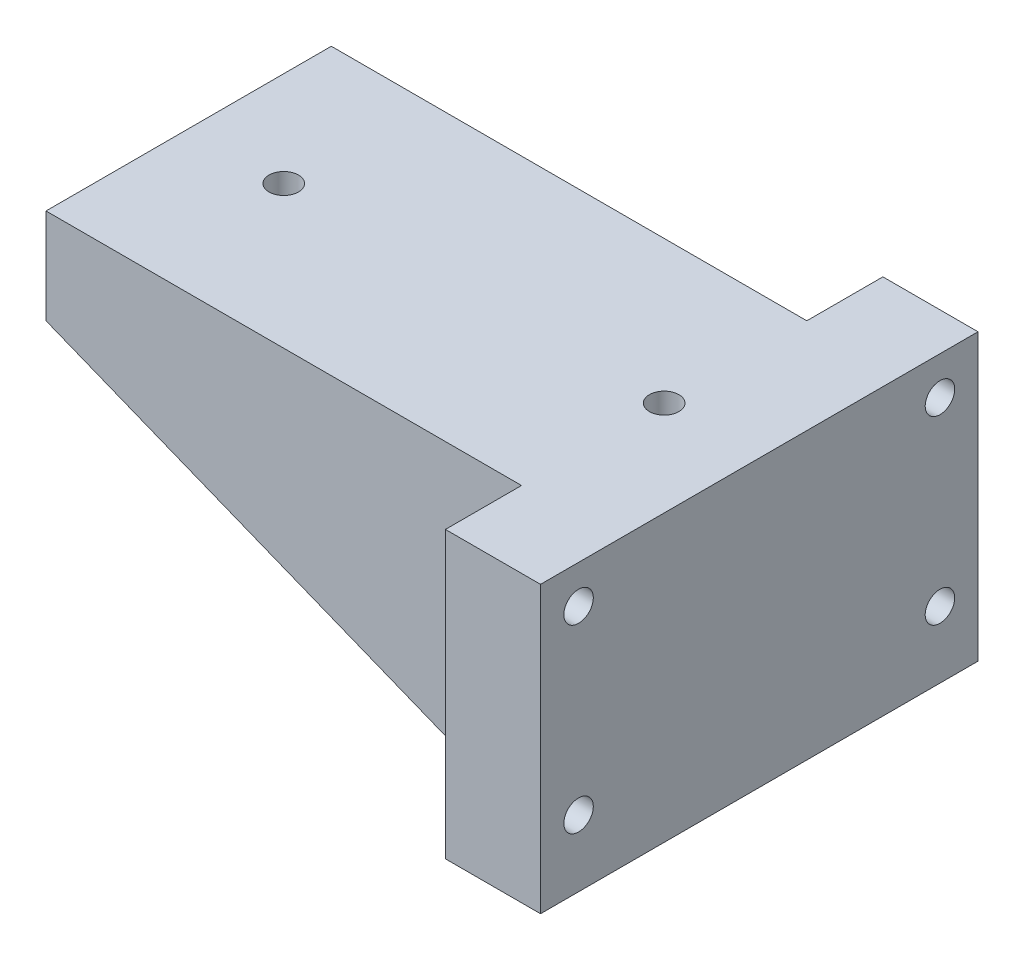
from build123d import *

# Parameters (mm, degrees)
SKETCH1_W           = 60
SKETCH1_H           = 30
SKETCH1_R           = 1.55
BOSS_EXTRUDE1_DEPTH = 10
SKETCH2_R           = 1.55
BOSS_EXTRUDE3_DEPTH = 10
SKETCH2_3_W         = 10
SKETCH2_3_H         = 20
BOSS_EXTRUDE4_DEPTH = 6
BOSS_EXTRUDE5_DEPTH = 6
BOSS_EXTRUDE6_DEPTH = 6


with BuildPart() as part:
    # Sketch1 → Boss-Extrude1 (new body)
    with BuildSketch(Plane(origin=(0, 0, 0), x_dir=(1, 0, 0), z_dir=(0, 1, 0))):
        Rectangle(SKETCH1_W, SKETCH1_H)
        with Locations((20, 0)):
            Circle(SKETCH1_R, mode=Mode.SUBTRACT)
        with Locations((-20, 0)):
            Circle(SKETCH1_R, mode=Mode.SUBTRACT)
    extrude(amount=BOSS_EXTRUDE1_DEPTH)

    # Sketch2 → Boss-Extrude3 (add)
    # profile 1 of 2: a face of its own
    with BuildSketch(Plane(origin=(30, 0, 0), x_dir=(0, 0, -1), z_dir=(1, 0, 0))):
        Polygon((-15, 10), (-23, 10), (-23, -20), (-5, -20), (-5, 0), (-15, 0), align=None)
        with Locations((-19, -13)):
            Circle(SKETCH2_R, mode=Mode.SUBTRACT)
        with Locations((-19, 6)):
            Circle(SKETCH2_R, mode=Mode.SUBTRACT)
    # profile 2 of 2: a face of its own
    with BuildSketch(Plane(origin=(30, 0, 0), x_dir=(0, 0, -1), z_dir=(1, 0, 0))):
        Polygon((23, 10), (15, 10), (15, 0), (5, 0), (5, -20), (23, -20), align=None)
        with Locations((19, -13)):
            Circle(SKETCH2_R, mode=Mode.SUBTRACT)
        with Locations((19, 6)):
            Circle(SKETCH2_R, mode=Mode.SUBTRACT)
    extrude(amount=-BOSS_EXTRUDE3_DEPTH)

    # Sketch2<3> → Boss-Extrude4 (add)
    with BuildSketch(Plane(origin=(30, 0, 0), x_dir=(0, 0, -1), z_dir=(1, 0, 0))):
        with Locations((0, -10)):
            Rectangle(SKETCH2_3_W, SKETCH2_3_H)
    extrude(amount=-BOSS_EXTRUDE4_DEPTH)

    # Sketch5 → Boss-Extrude5 (add)
    with BuildSketch(Plane(origin=(0, 0, -15), x_dir=(-1, 0, 0), z_dir=(0, 0, -1))):
        Polygon((-20, -20), (30, 0), (-20, 0), align=None)
    extrude(amount=-BOSS_EXTRUDE5_DEPTH)

    # Sketch6 → Boss-Extrude6 (add)
    with BuildSketch(Plane.XY.offset(15)):
        Polygon((20, -20), (20, 0), (-30, 0), align=None)
    extrude(amount=-BOSS_EXTRUDE6_DEPTH)


solid = part.part
